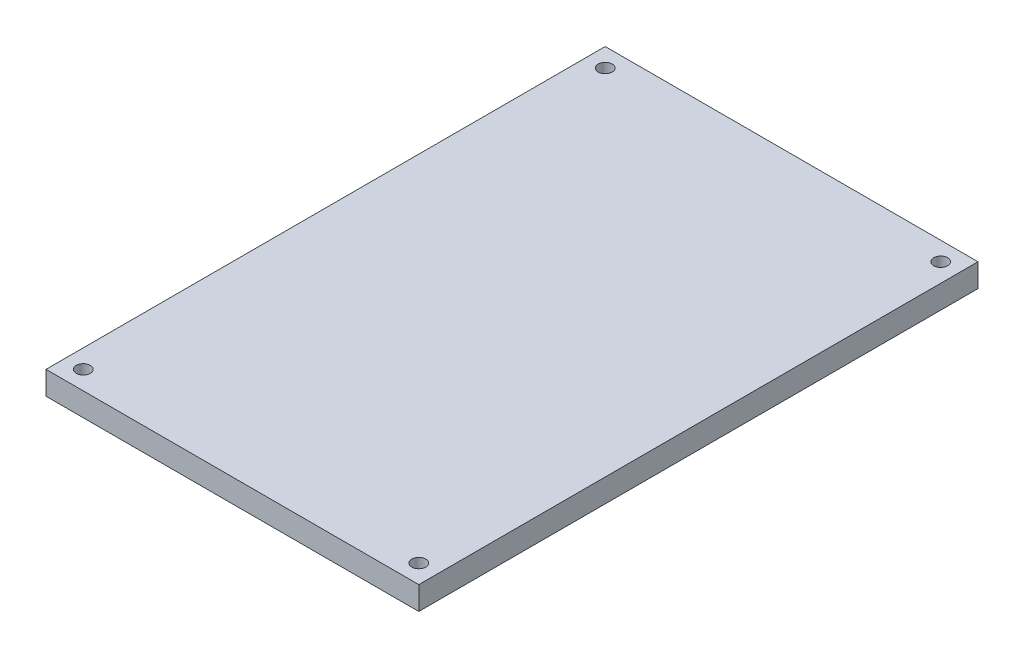
from build123d import *

# Parameters (mm, degrees)
SKETCH1_W           = 80
SKETCH1_H           = 120
BOSS_EXTRUDE1_DEPTH = 5
SKETCH2_R           = 1.5
CUT_EXTRUDE1_DEPTH  = 145.308696897
SKETCH3_R           = 1.5
CUT_EXTRUDE2_DEPTH  = 145.308696897


with BuildPart() as part:
    # Sketch1 → Boss-Extrude1 (new body)
    with BuildSketch(Plane(origin=(0, 0, 0), x_dir=(1, 0, 0), z_dir=(0, 1, 0))):
        with Locations((-40, 60)):
            Rectangle(SKETCH1_W, SKETCH1_H)
    extrude(amount=BOSS_EXTRUDE1_DEPTH)

    # Sketch2 → Cut-Extrude1 (cut, through all)
    with BuildSketch(Plane(origin=(0, 5, 0), x_dir=(1, 0, 0), z_dir=(0, 1, 0))):
        with Locations(Location((-76, 116, 0), (0, 0, 270))):
            Circle(SKETCH2_R)
    cut_extrude1 = extrude(amount=-CUT_EXTRUDE1_DEPTH, mode=Mode.SUBTRACT)

    # Sketch3 → Cut-Extrude2 (cut, through all)
    with BuildSketch(Plane(origin=(0, 5, 0), x_dir=(1, 0, 0), z_dir=(0, 1, 0))):
        with Locations(Location((-4, 116, 0), (0, 0, 270))):
            Circle(SKETCH3_R)
    cut_extrude2 = extrude(amount=-CUT_EXTRUDE2_DEPTH, mode=Mode.SUBTRACT)

    # Mirror1: Cut-Extrude1, Cut-Extrude2 across plane
    add(cut_extrude1.mirror(Plane.XY.offset(-60)), mode=Mode.SUBTRACT)
    add(cut_extrude2.mirror(Plane.XY.offset(-60)), mode=Mode.SUBTRACT)


solid = part.part
